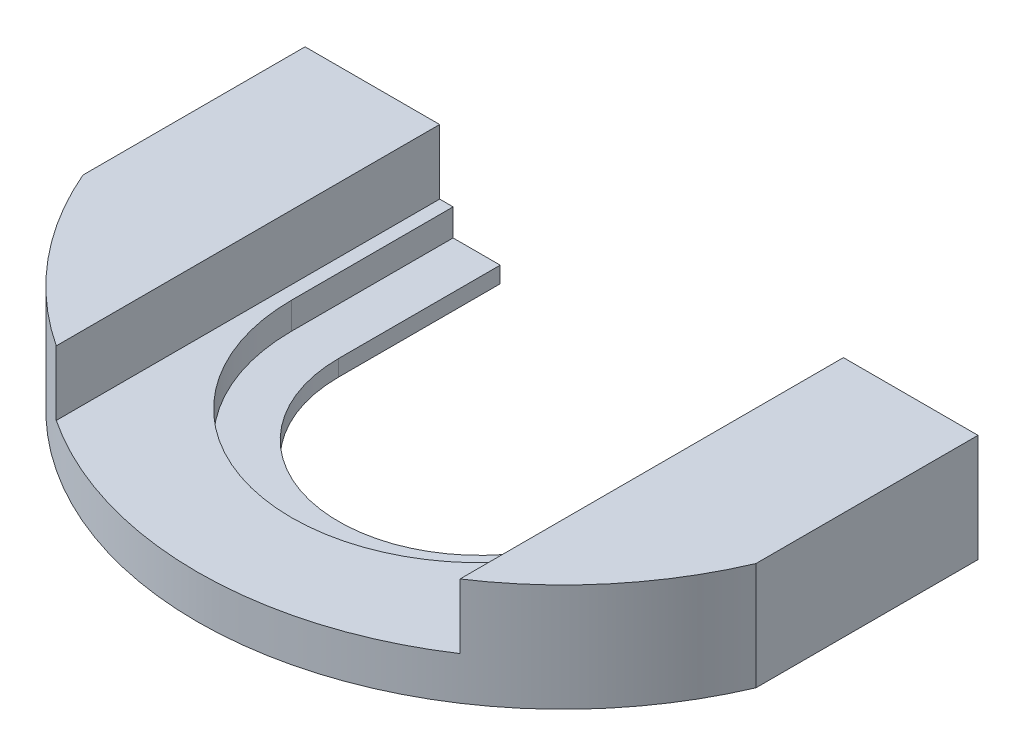
from build123d import *

# Parameters (mm, degrees)
ESQUISSE1_W             = 10
ESQUISSE1_H             = 8
ESQUISSE1_W_2           = 30
ESQUISSE1_H_2           = 1.2
BOSS_EXTRU_1_DEPTH      = 33
ENL_V_MAT_EXTRU_3_DEPTH = 30
BOSS_EXTRU_2_DEPTH      = 2
ESQUISSE4_R             = 1.5
ENL_V_MAT_EXTRU_4_DEPTH = 10
ENL_V_MAT_EXTRU_5_DEPTH = 53.469038489


with BuildPart() as part:
    # Esquisse1 → Boss.-Extru.1 (new body)
    with BuildSketch(Plane.XY):
        with Locations((-35, 4)):
            Rectangle(ESQUISSE1_W, ESQUISSE1_H)
        with Locations((5, 4)):
            Rectangle(ESQUISSE1_W, ESQUISSE1_H)
        with Locations((-15, 0.6)):
            Rectangle(ESQUISSE1_W_2, ESQUISSE1_H_2)
    extrude(amount=BOSS_EXTRU_1_DEPTH)

    # Esquisse2 → Enlèv. mat.-Extru.3 (cut)
    with BuildSketch(Plane.XZ):
        with BuildLine():
            Line((-4.5, 0), (-4.5, 12))
            ThreePointArc((-4.5, 12), (-15, 22.5), (-25.5, 12))
            Line((-25.5, 12), (-25.5, 0))
            Line((-25.5, 0), (-4.5, 0))
        make_face()
    extrude(amount=-ENL_V_MAT_EXTRU_3_DEPTH, mode=Mode.SUBTRACT)

    # Esquisse3 → Boss.-Extru.2 (add)
    with BuildSketch(Plane(origin=(0, 1.2, 0), x_dir=(1, 0, 0), z_dir=(0, 1, 0))):
        with BuildLine():
            ThreePointArc((-1, -12), (-15, -26), (-29, -12))
            Line((-29, -12), (-29, 0))
            Line((-29, 0), (-30, 0))
            Line((-30, 0), (-30, -33))
            Line((-30, -33), (0, -33))
            Line((0, -33), (0, 0))
            Line((0, 0), (-1, 0))
            Line((-1, 0), (-1, -12))
        make_face()
    extrude(amount=BOSS_EXTRU_2_DEPTH)

    # Esquisse4 → Enlèv. mat.-Extru.4 (cut)
    with BuildSketch(Plane(origin=(0, 0, 0), x_dir=(-1, 0, 0), z_dir=(0, 0, -1))):
        with Locations((35, 4)):
            Circle(ESQUISSE4_R)
        with Locations((-5, 4)):
            Circle(ESQUISSE4_R)
    extrude(amount=-ENL_V_MAT_EXTRU_4_DEPTH, mode=Mode.SUBTRACT)

    # Esquisse5 → Enlèv. mat.-Extru.5 (cut, through all)
    with BuildSketch(Plane.XZ):
        with BuildLine():
            Line((-40, 33), (-40, 16.5))
            ThreePointArc((-40, 16.5), (-29.977065819, 28.503129989), (-15.000000044, 33))
            Line((-15.000000044, 33), (-40, 33))
        make_face()
        with BuildLine():
            Line((10, 33), (-15.000000044, 33))
            ThreePointArc((-15.000000044, 33), (-0.022934218, 28.503130013), (10, 16.5))
            Line((10, 16.5), (10, 33))
        make_face()
    extrude(amount=-ENL_V_MAT_EXTRU_5_DEPTH, mode=Mode.SUBTRACT)


solid = part.part
